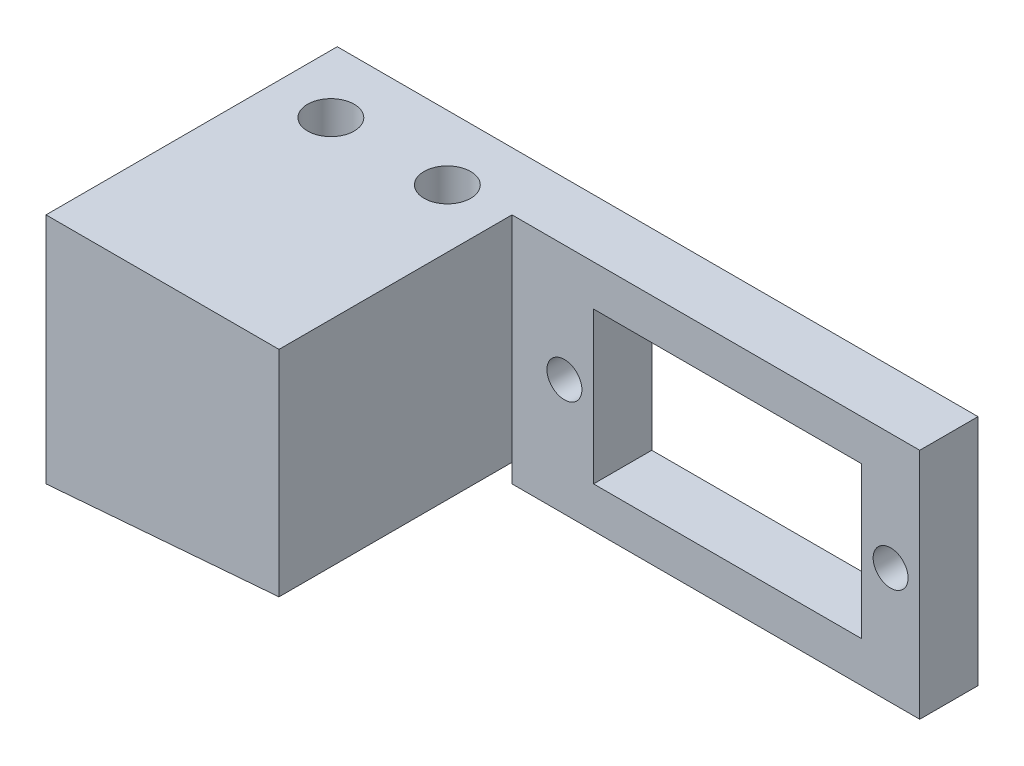
from build123d import *

# Parameters (mm, degrees)
ESQUISSE1_W             = 55
ESQUISSE1_H             = 20
BOSS_EXTRU_1_DEPTH      = 5
ESQUISSE3_R             = 1.5
ESQUISSE3_W             = 23
ESQUISSE3_H             = 13
ENL_V_MAT_EXTRU_2_DEPTH = 20
BOSS_EXTRU_2_DEPTH      = 25
ESQUISSE2_R             = 2
ENL_V_MAT_EXTRU_1_DEPTH = 20
ENL_V_MAT_EXTRU_4_DEPTH = 15


with BuildPart() as part:
    # Esquisse1 → Boss.-Extru.1 (new body)
    with BuildSketch(Plane.XY):
        with Locations((-0.833333333, -1.666666667)):
            Rectangle(ESQUISSE1_W, ESQUISSE1_H)
    extrude(amount=BOSS_EXTRU_1_DEPTH)

    # Esquisse3 → Enlèv. mat.-Extru.2 (cut)
    with BuildSketch(Plane.XY.offset(5)):
        with Locations((24.166666667, -1.666666667)):
            Circle(ESQUISSE3_R)
        with Locations((-3.833333333, -1.666666667)):
            Circle(ESQUISSE3_R)
        with Locations((10.166666667, -1.666666667)):
            Rectangle(ESQUISSE3_W, ESQUISSE3_H)
    extrude(amount=-ENL_V_MAT_EXTRU_2_DEPTH, mode=Mode.SUBTRACT)

    # Esquisse5 → Boss.-Extru.2 (add)
    with BuildSketch(Plane(origin=(0, 0, 0), x_dir=(-1, 0, 0), z_dir=(0, 0, -1))):
        Polygon((28.333333333, -11.666666667), (28.333333333, 8.333333333), (8.333333333, 8.333333333), (8.333333333, -10.066666667), align=None)
    extrude(amount=-BOSS_EXTRU_2_DEPTH)

    # Esquisse2 → Enlèv. mat.-Extru.1 (cut)
    with BuildSketch(Plane(origin=(0, 8.333333333, 0), x_dir=(1, 0, 0), z_dir=(0, 1, 0))):
        with Locations(Location((-23.333333333, -5.548124667, 0), (0, 0, 270))):
            Circle(ESQUISSE2_R)
        with Locations(Location((-13.333333333, -5.548124667, 0), (0, 0, 270))):
            Circle(ESQUISSE2_R)
    extrude(amount=-ENL_V_MAT_EXTRU_1_DEPTH, mode=Mode.SUBTRACT)

    # Esquisse7 → Enlèv. mat.-Extru.4 (cut)
    with BuildSketch(Plane.XY.offset(5)):
        Polygon((-8.333333333, -10.066666667), (-8.333333333, -11.666666667), (-28.333333333, -11.666666667), align=None)
    extrude(amount=-ENL_V_MAT_EXTRU_4_DEPTH, mode=Mode.SUBTRACT)


solid = part.part
